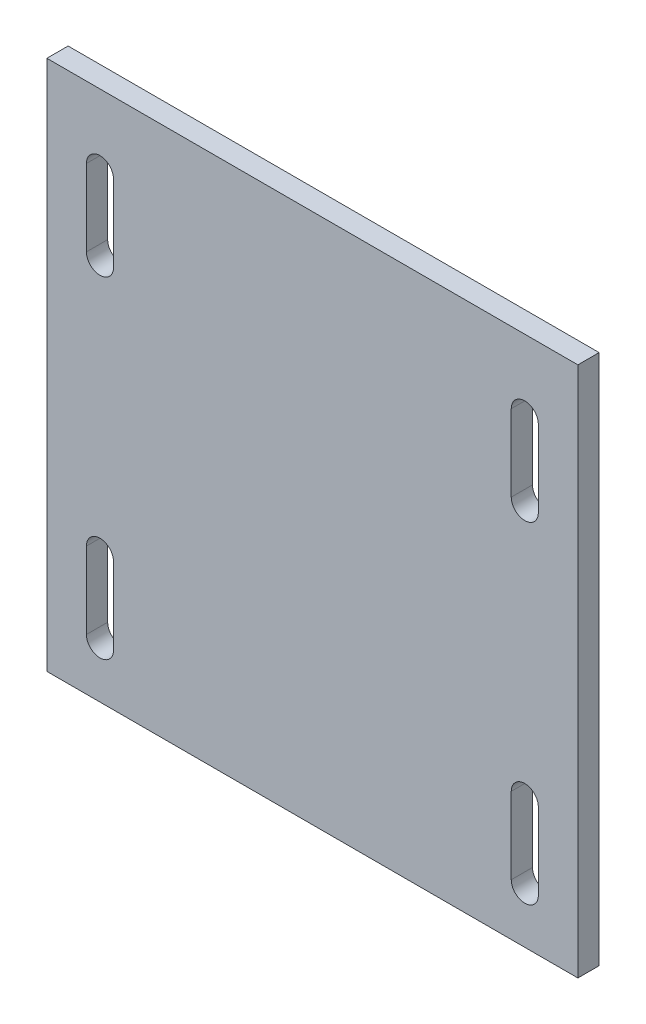
from build123d import *

# Parameters (mm, degrees)
BOSS_EXTRUDE1_DEPTH = 4


with BuildPart() as part:
    # Sketch1 → Boss-Extrude1 (new body)
    with BuildSketch(Plane.XY):
        Polygon((0, 0), (0, 90), (100, 90), (100, 2.372295937), (100, -10), (0, -10), align=None)
        with BuildLine():
            Line((7.45, 14.17243776), (7.45, -0.25030049))
            ThreePointArc((7.45, -0.25030049), (10, -2.80030049), (12.55, -0.25030049))
            Line((12.55, -0.25030049), (12.55, 14.17243776))
            ThreePointArc((12.55, 14.17243776), (10, 16.72243776), (7.45, 14.17243776))
        make_face(mode=Mode.SUBTRACT)
        with BuildLine():
            Line((87.45, 62.150571419), (87.45, 76.57330967))
            ThreePointArc((87.45, 76.57330967), (90, 79.12330967), (92.55, 76.57330967))
            Line((92.55, 76.57330967), (92.55, 62.150571419))
            ThreePointArc((92.55, 62.150571419), (90, 59.600571419), (87.45, 62.150571419))
        make_face(mode=Mode.SUBTRACT)
        with BuildLine():
            Line((92.55, 14.17243776), (92.55, -0.25030049))
            ThreePointArc((92.55, -0.25030049), (90, -2.80030049), (87.45, -0.25030049))
            Line((87.45, -0.25030049), (87.45, 14.17243776))
            ThreePointArc((87.45, 14.17243776), (90, 16.72243776), (92.55, 14.17243776))
        make_face(mode=Mode.SUBTRACT)
        with BuildLine():
            Line((12.55, 62.150571419), (12.55, 76.57330967))
            ThreePointArc((12.55, 76.57330967), (10, 79.12330967), (7.45, 76.57330967))
            Line((7.45, 76.57330967), (7.45, 62.150571419))
            ThreePointArc((7.45, 62.150571419), (10, 59.600571419), (12.55, 62.150571419))
        make_face(mode=Mode.SUBTRACT)
    extrude(amount=BOSS_EXTRUDE1_DEPTH)


solid = part.part
